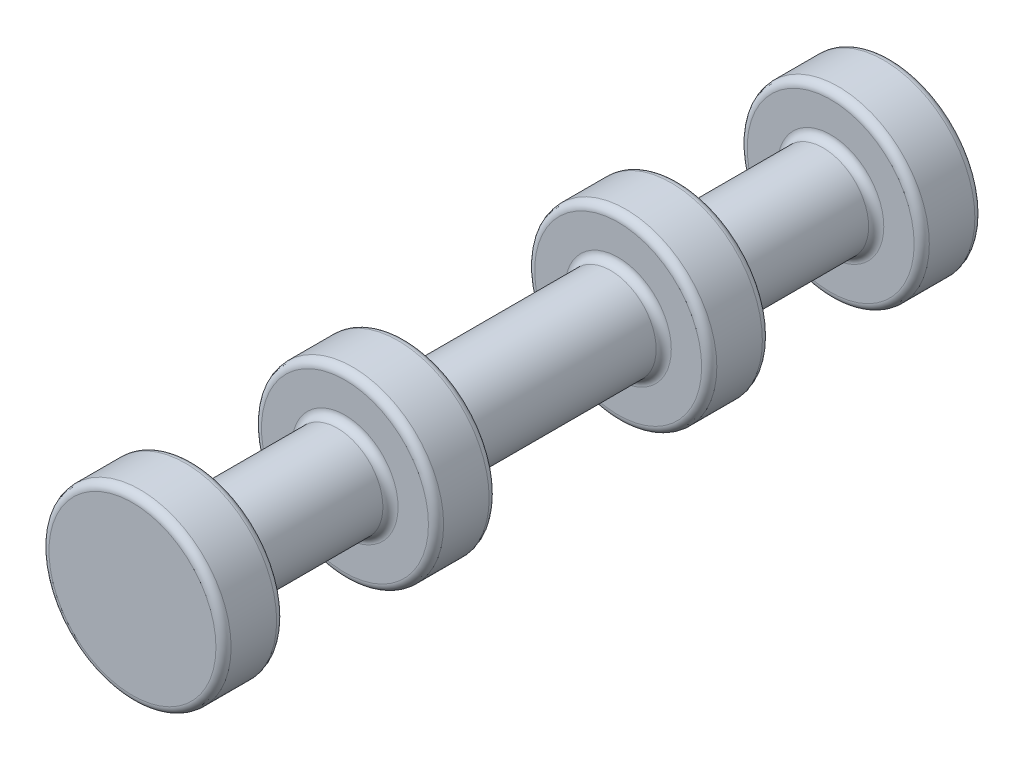
from build123d import *


with BuildPart() as part:
    # Sketch1 → Revolve1 (revolve)
    with BuildSketch(Plane(origin=(0, 0, 0), x_dir=(1, 0, 0), z_dir=(0, 1, 0)), mode=Mode.PRIVATE) as revolve1_sk:
        with BuildLine():
            Line((-0.848047538, -9.767402377), (-3.598047538, -9.767402377))
            ThreePointArc((-3.598047538, -9.767402377), (-3.774824233, -9.694179072), (-3.848047538, -9.517402377))
            Line((-3.848047538, -9.517402377), (-3.848047538, -8.017402377))
            ThreePointArc((-3.848047538, -8.017402377), (-3.774824233, -7.840625682), (-3.598047538, -7.767402377))
            Line((-3.598047538, -7.767402377), (-2.598047538, -7.767402377))
            ThreePointArc((-2.598047538, -7.767402377), (-2.421270843, -7.694179072), (-2.348047538, -7.517402377))
            Line((-2.348047538, -7.517402377), (-2.348047538, -3.017402377))
            ThreePointArc((-2.348047538, -3.017402377), (-2.421270843, -2.840625682), (-2.598047538, -2.767402377))
            Line((-2.598047538, -2.767402377), (-3.598047538, -2.767402377))
            ThreePointArc((-3.598047538, -2.767402377), (-3.774824233, -2.694179072), (-3.848047538, -2.517402377))
            Line((-3.848047538, -2.517402377), (-3.848047538, -1.017402377))
            ThreePointArc((-3.848047538, -1.017402377), (-3.774824233, -0.840625682), (-3.598047538, -0.767402377))
            Line((-3.598047538, -0.767402377), (-2.598047538, -0.767402377))
            ThreePointArc((-2.598047538, -0.767402377), (-2.421270843, -0.694179072), (-2.348047538, -0.517402377))
            Line((-2.348047538, -0.517402377), (-2.348047538, 5.982597623))
            ThreePointArc((-2.348047538, 5.982597623), (-2.421270843, 6.159374318), (-2.598047538, 6.232597623))
            Line((-2.598047538, 6.232597623), (-3.598047538, 6.232597623))
            ThreePointArc((-3.598047538, 6.232597623), (-3.774824233, 6.305820928), (-3.848047538, 6.482597623))
            Line((-3.848047538, 6.482597623), (-3.848047538, 7.982597623))
            ThreePointArc((-3.848047538, 7.982597623), (-3.774824233, 8.159374318), (-3.598047538, 8.232597623))
            Line((-3.598047538, 8.232597623), (-2.598047538, 8.232597623))
            ThreePointArc((-2.598047538, 8.232597623), (-2.421270843, 8.305820928), (-2.348047538, 8.482597623))
            Line((-2.348047538, 8.482597623), (-2.348047538, 12.982597623))
            ThreePointArc((-2.348047538, 12.982597623), (-2.421270843, 13.159374318), (-2.598047538, 13.232597623))
            Line((-2.598047538, 13.232597623), (-3.598047538, 13.232597623))
            ThreePointArc((-3.598047538, 13.232597623), (-3.774824233, 13.305820928), (-3.848047538, 13.482597623))
            Line((-3.848047538, 13.482597623), (-3.848047538, 14.982597623))
            ThreePointArc((-3.848047538, 14.982597623), (-3.774824233, 15.159374318), (-3.598047538, 15.232597623))
            Line((-3.598047538, 15.232597623), (-0.848047538, 15.232597623))
            Line((-0.848047538, 15.232597623), (-0.848047538, -9.767402377))
        make_face()
    revolve(revolve1_sk.sketch.rotate(Axis((-0.848047538, 0, -0.674023769), (0, 0, -1)), 180), axis=Axis((-0.848047538, 0, -0.674023769), (0, 0, -1)))


solid = part.part
